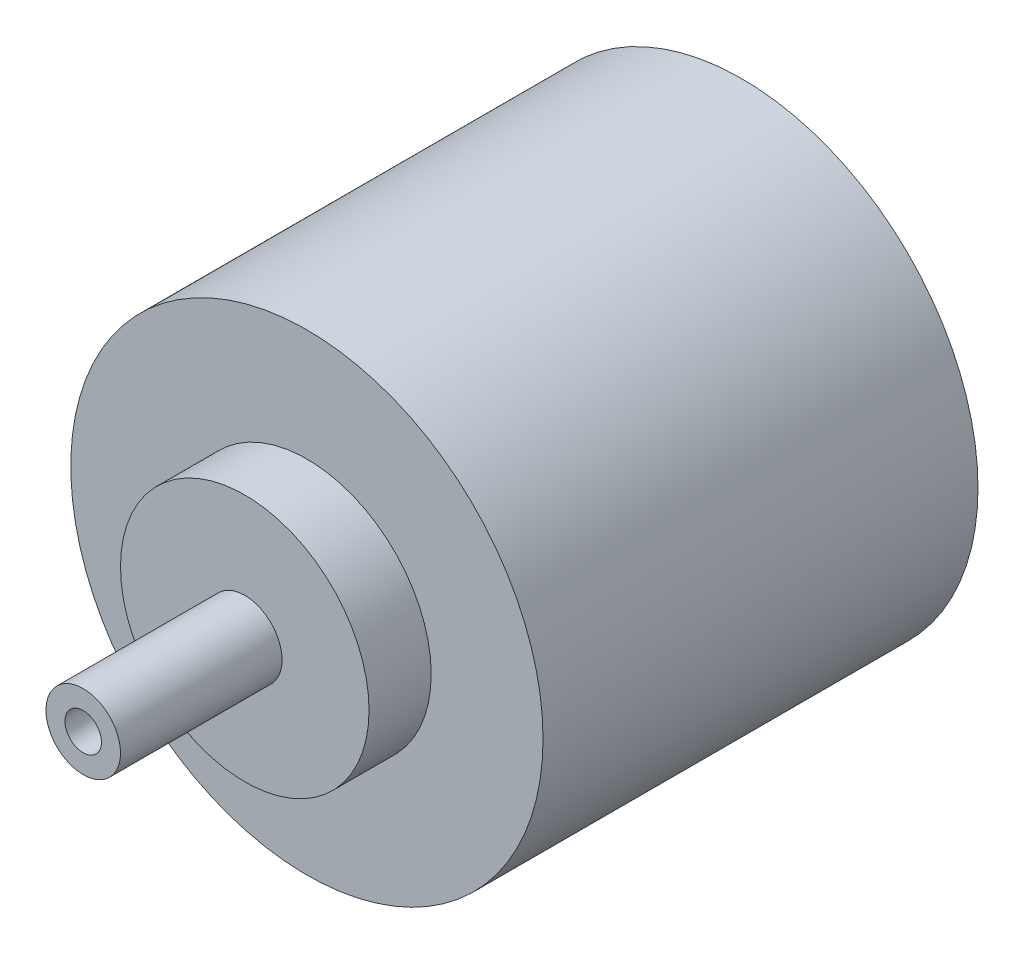
from build123d import *


with BuildPart() as part:
    # Sketch1 → Revolve1 (revolve)
    with BuildSketch(Plane(origin=(0, 0, 0), x_dir=(0, 0, -1), z_dir=(1, 0, 0)), mode=Mode.PRIVATE) as revolve1_sk:
        Polygon((0, 1.470982353), (0, 3), (13, 3), (13, 10), (18, 10), (18, 19), (53, 19), (53, 0), (16.249644704, 0), (16.249644704, 1.470982353), align=None)
    revolve(revolve1_sk.sketch.rotate(Axis((0, 0, -16.249644704), (0, 0, -1)), 90), axis=Axis((0, 0, -16.249644704), (0, 0, -1)))


solid = part.part
